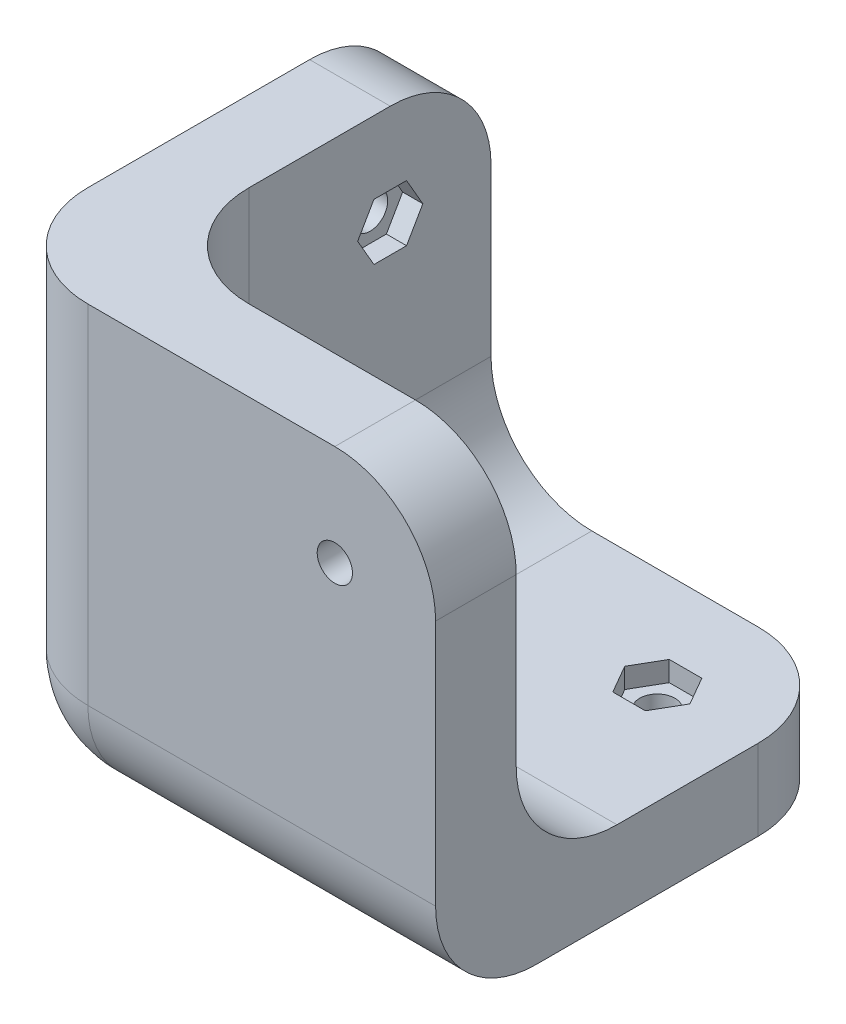
from build123d import *

# Parameters (mm, degrees)
SKETCH1_W           = 4
SKETCH1_H           = 10
SKETCH1_H_2         = 30.5
SKETCH1_W_2         = 34.5
SKETCH1_H_3         = 4
SKETCH1_W_3         = 26.5
SKETCH1_W_4         = 10
BOSS_EXTRUDE1_DEPTH = 42
CUT_EXTRUDE1_DEPTH  = 34
SKETCH3_R           = 1.75
CUT_EXTRUDE2_DEPTH  = 72.529714105
SKETCH3_3_R         = 1.75
CUT_EXTRUDE3_DEPTH  = 2
SKETCH4_R           = 1.75
CUT_EXTRUDE4_DEPTH  = 72.249561402
SKETCH4_3_R         = 1.75
CUT_EXTRUDE5_DEPTH  = 2
SKETCH5_R           = 1.75
CUT_EXTRUDE6_DEPTH  = 72.249561402
SKETCH5_3_R         = 1.75
CUT_EXTRUDE7_DEPTH  = 2
FILLET1_R           = 10


with BuildPart() as part:
    # Sketch1 → Boss-Extrude1 (new body)
    with BuildSketch(Plane.XY):
        Polygon((8, 8), (34.5, 8), (44.5, 8), (44.5, 44.5), (8, 44.5), (8, 34.5), align=None)
        with Locations((6, 39.5)):
            Rectangle(SKETCH1_W, SKETCH1_H)
        with Locations((2, 39.5)):
            Rectangle(SKETCH1_W, SKETCH1_H)
        with Locations((2, 19.25)):
            Rectangle(SKETCH1_W, SKETCH1_H_2)
        Polygon((4, 34.5), (4, 4), (8, 4), (8, 8), (8, 34.5), align=None)
        with Locations((17.25, 2)):
            Rectangle(SKETCH1_W_2, SKETCH1_H_3)
        with Locations((21.25, 6)):
            Rectangle(SKETCH1_W_3, SKETCH1_H_3)
        with Locations((39.5, 6)):
            Rectangle(SKETCH1_W_4, SKETCH1_H_3)
        with Locations((39.5, 2)):
            Rectangle(SKETCH1_W_4, SKETCH1_H_3)
    extrude(amount=BOSS_EXTRUDE1_DEPTH)

    # Sketch1<3> → Cut-Extrude1 (cut)
    with BuildSketch(Plane.XY):
        Polygon((8, 8), (34.5, 8), (44.5, 8), (44.5, 44.5), (8, 44.5), (8, 34.5), align=None)
    extrude(amount=CUT_EXTRUDE1_DEPTH, mode=Mode.SUBTRACT)

    # Sketch3 → Cut-Extrude2 (cut, through all)
    with BuildSketch(Plane(origin=(0, 0, 34), x_dir=(-1, 0, 0), z_dir=(0, 0, -1))):
        with Locations((-34.5, 34.5)):
            Circle(SKETCH3_R)
    extrude(amount=-CUT_EXTRUDE2_DEPTH, mode=Mode.SUBTRACT)

    # Sketch3<3> → Cut-Extrude3 (cut)
    with BuildSketch(Plane(origin=(0, 0, 34), x_dir=(-1, 0, 0), z_dir=(0, 0, -1))):
        Polygon((-31.266838493, 34.5), (-32.883419246, 37.3), (-36.116580754, 37.3), (-37.733161507, 34.5), (-36.116580754, 31.7), (-32.883419246, 31.7), align=None)
        with Locations((-34.5, 34.5)):
            Circle(SKETCH3_3_R, mode=Mode.SUBTRACT)
    extrude(amount=-CUT_EXTRUDE3_DEPTH, mode=Mode.SUBTRACT)

    # Sketch4 → Cut-Extrude4 (cut, through all)
    with BuildSketch(Plane(origin=(8, 0, 0), x_dir=(0, 0, -1), z_dir=(1, 0, 0))):
        with Locations(Location((-10, 34.5, 0), (0, 0, 90))):
            Circle(SKETCH4_R)
    extrude(amount=-CUT_EXTRUDE4_DEPTH, mode=Mode.SUBTRACT)

    # Sketch4<3> → Cut-Extrude5 (cut)
    with BuildSketch(Plane(origin=(8, 0, 0), x_dir=(0, 0, -1), z_dir=(1, 0, 0))):
        Polygon((-6.766838493, 34.5), (-8.383419246, 37.3), (-11.616580754, 37.3), (-13.233161507, 34.5), (-11.616580754, 31.7), (-8.383419246, 31.7), align=None)
        with Locations(Location((-10, 34.5, 0), (0, 0, 90))):
            Circle(SKETCH4_3_R, mode=Mode.SUBTRACT)
    extrude(amount=-CUT_EXTRUDE5_DEPTH, mode=Mode.SUBTRACT)

    # Sketch5 → Cut-Extrude6 (cut, through all)
    with BuildSketch(Plane(origin=(0, 8, 0), x_dir=(1, 0, 0), z_dir=(0, 1, 0))):
        with Locations(Location((34.5, -10, 0), (0, 0, 270))):
            Circle(SKETCH5_R)
    extrude(amount=-CUT_EXTRUDE6_DEPTH, mode=Mode.SUBTRACT)

    # Sketch5<3> → Cut-Extrude7 (cut)
    with BuildSketch(Plane(origin=(0, 8, 0), x_dir=(1, 0, 0), z_dir=(0, 1, 0))):
        Polygon((37.733161507, -10), (36.116580754, -7.2), (32.883419246, -7.2), (31.266838493, -10), (32.883419246, -12.8), (36.116580754, -12.8), align=None)
        with Locations(Location((34.5, -10, 0), (0, 0, 270))):
            Circle(SKETCH5_3_R, mode=Mode.SUBTRACT)
    extrude(amount=-CUT_EXTRUDE7_DEPTH, mode=Mode.SUBTRACT)

    # Fillet1
    fillet1_edges = [part.edges().sort_by_distance(p)[0] for p in [
        (44.5, 44.5, 38),
        (0, 0, 21),
        (0, 22.25, 42),
        (44.5, 4, 0),
        (22.25, 0, 42),
        (8, 8, 17),
        (8, 26.25, 34),
        (26.25, 8, 34),
        (4, 44.5, 0),
    ]]
    fillet(fillet1_edges, radius=FILLET1_R)


solid = part.part
